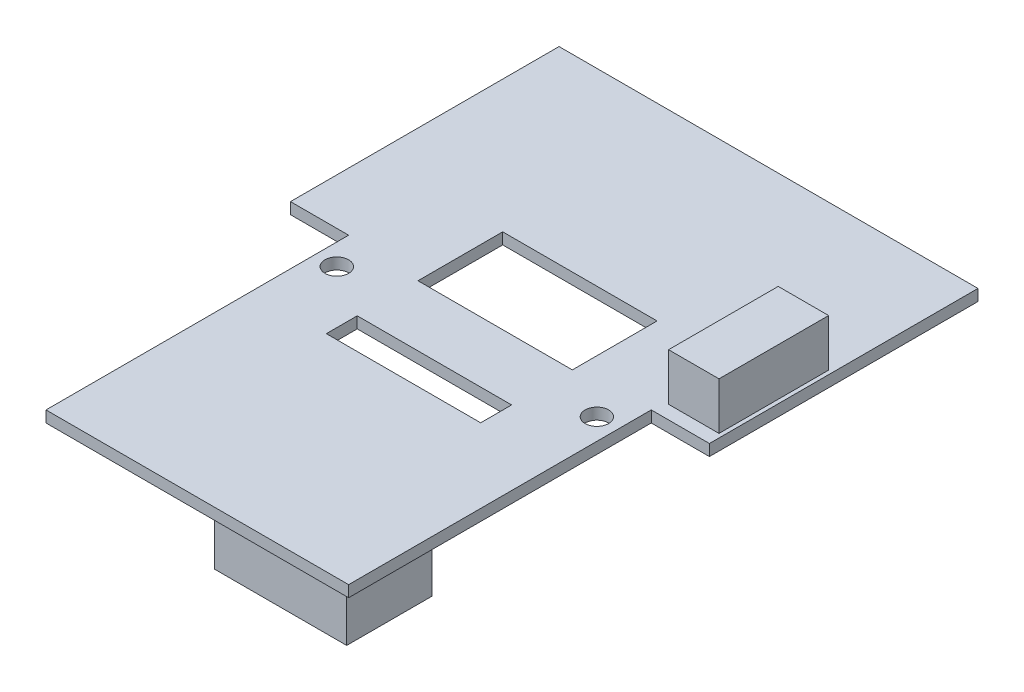
from build123d import *

# Parameters (mm, degrees)
SKETCH_1_R      = 1.25
SKETCH_1_W      = 16.323541982
SKETCH_1_H      = 8.961255986
SKETCH_1_H_2    = 3.269836796
EXTRUDE_1_DEPTH = 1.2
SKETCH_2_W      = 5.33414326
SKETCH_2_H      = 11.592185383
EXTRUDE_2_DEPTH = 5
SKETCH_3_W      = 14
SKETCH_3_H      = 9
EXTRUDE_3_DEPTH = 5


with BuildPart() as part:
    # 草图1 → 凸台-拉伸1 (new body)
    with BuildSketch(Plane(origin=(0, 0, 0), x_dir=(1, 0, 0), z_dir=(0, 1, 0))):
        Polygon((16, 0), (16, -32), (-16, -32), (-16, 0), (-22.15, 0), (-22.15, 28.4), (22.15, 28.4), (22.15, 0), align=None)
        with Locations(Location((13.75, -3.5, 0), (0, 0, 270))):
            Circle(SKETCH_1_R, mode=Mode.SUBTRACT)
        with Locations(Location((-13.75, -3.5, 0), (0, 0, 90))):
            Circle(SKETCH_1_R, mode=Mode.SUBTRACT)
        with Locations((0, 3.973903908)):
            Rectangle(SKETCH_1_W, SKETCH_1_H, mode=Mode.SUBTRACT)
        with Locations((0, -8.562744205)):
            Rectangle(SKETCH_1_W, SKETCH_1_H_2, mode=Mode.SUBTRACT)
    extrude(amount=EXTRUDE_1_DEPTH)

    # 草图2 → 凸台-拉伸2 (add)
    with BuildSketch(Plane(origin=(0, 1.2, 0), x_dir=(1, 0, 0), z_dir=(0, 1, 0))):
        with Locations((19.068534732, 7.22523066)):
            Rectangle(SKETCH_2_W, SKETCH_2_H)
    extrude(amount=EXTRUDE_2_DEPTH)

    # 草图3 → 凸台-拉伸3 (add)
    with BuildSketch(Plane.XZ):
        with Locations((8.26747858, 26.972724501)):
            Rectangle(SKETCH_3_W, SKETCH_3_H)
    extrude(amount=EXTRUDE_3_DEPTH)


solid = part.part
